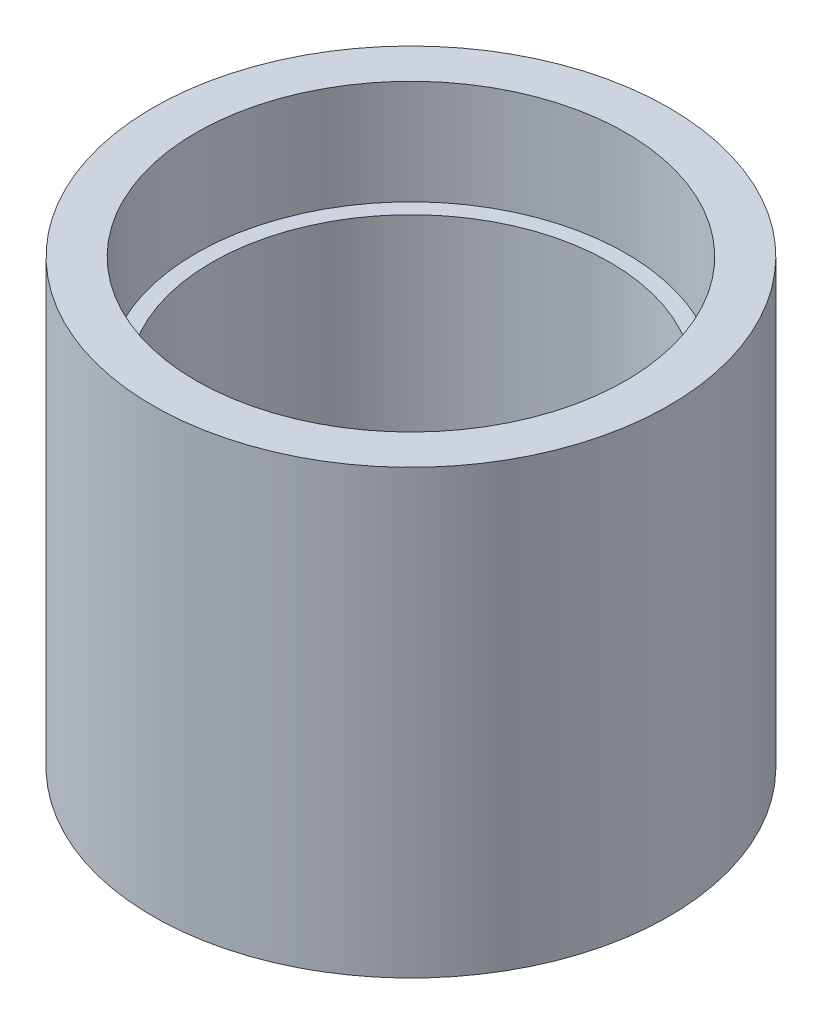
from build123d import *

# Parameters (mm, degrees)
SKETCH1_R           = 22.225
BOSS_EXTRUDE1_DEPTH = 38.1
SKETCH2_R           = 18.5039
CUT_EXTRUDE1_DEPTH  = 8.9916
CUT_EXTRUDE2_START  = -8.9916
SKETCH4_R           = 18.5039
CUT_EXTRUDE2_DEPTH  = 8.9916
SKETCH5_R           = 17.145
CUT_EXTRUDE3_DEPTH  = 43.839236694


with BuildPart() as part:
    # Sketch1 → Boss-Extrude1 (new body)
    with BuildSketch(Plane(origin=(0, 0, 0), x_dir=(1, 0, 0), z_dir=(0, 1, 0))):
        with Locations(Location((0, 0, 0), (0, 0, 90))):
            Circle(SKETCH1_R)
    extrude(amount=BOSS_EXTRUDE1_DEPTH)

    # Sketch2 → Cut-Extrude1 (cut)
    with BuildSketch(Plane(origin=(0, 38.1, 0), x_dir=(1, 0, 0), z_dir=(0, 1, 0))):
        with Locations(Location((0, 0, 0), (0, 0, 270))):
            Circle(SKETCH2_R)
    extrude(amount=-CUT_EXTRUDE1_DEPTH, mode=Mode.SUBTRACT)

    # Sketch4 → Cut-Extrude2 (cut)
    with BuildSketch(Plane.XZ.offset(CUT_EXTRUDE2_START)):
        with Locations(Location((0, 0, 0), (0, 0, 90))):
            Circle(SKETCH4_R)
    extrude(amount=CUT_EXTRUDE2_DEPTH, mode=Mode.SUBTRACT)

    # Sketch5 → Cut-Extrude3 (cut, through all)
    with BuildSketch(Plane.XZ.offset(-8.9916)):
        with Locations(Location((0, 0, 0), (0, 0, 270))):
            Circle(SKETCH5_R)
    extrude(amount=-CUT_EXTRUDE3_DEPTH, mode=Mode.SUBTRACT)


solid = part.part
